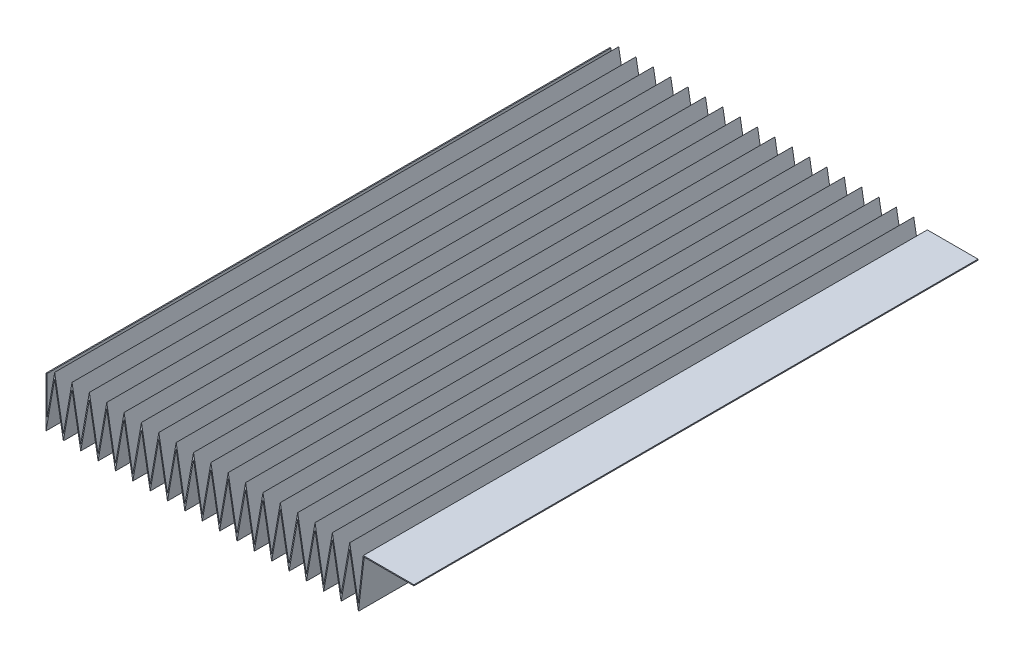
from build123d import *

# Parameters (mm, degrees)
EXTRUDE_THIN1_DEPTH = 85


with BuildPart() as part:
    # Sketch1 → Extrude-Thin1 (new, symmetric)
    with BuildSketch(Plane.XY):
        Polygon((0, 15.1), (0, 0), (2.615768825, 14.871709836), (5.23153765, 0), (7.847306476, 14.871709836), (10.463075301, 0), (13.078844126, 14.871709836), (15.694612951, 0), (18.310381776, 14.871709836), (20.926150602, 0), (23.541919427, 14.871709836), (26.157688252, 0), (28.773457077, 14.871709836), (31.389225902, 0), (34.004994728, 14.871709836), (36.620763553, 0), (39.236532378, 14.871709836), (41.852301203, 0), (44.468070028, 14.871709836), (47.083838854, 0), (49.699607679, 14.871709836), (52.315376504, 0), (54.931145329, 14.871709836), (57.546914154, 0), (60.16268298, 14.871709836), (62.778451805, 0), (65.39422063, 14.871709836), (68.009989455, 0), (70.62575828, 14.871709836), (73.241527106, 0), (75.857295931, 14.871709836), (78.473064756, 0), (81.088833581, 14.871709836), (83.704602406, 0), (86.320371232, 14.871709836), (88.936140057, 0), (91.551908882, 14.871709836), (94.167677707, 0), (95.902612864, 15), (110.902612864, 15), (110.902612864, 15.3), (95.635311568, 15.3), (94.106326229, 2.080612527), (91.551908882, 16.603514251), (88.936140057, 1.731804415), (86.320371232, 16.603514251), (83.704602406, 1.731804415), (81.088833581, 16.603514251), (78.473064756, 1.731804415), (75.857295931, 16.603514251), (73.241527106, 1.731804415), (70.62575828, 16.603514251), (68.009989455, 1.731804415), (65.39422063, 16.603514251), (62.778451805, 1.731804415), (60.16268298, 16.603514251), (57.546914154, 1.731804415), (54.931145329, 16.603514251), (52.315376504, 1.731804415), (49.699607679, 16.603514251), (47.083838854, 1.731804415), (44.468070028, 16.603514251), (41.852301203, 1.731804415), (39.236532378, 16.603514251), (36.620763553, 1.731804415), (34.004994728, 16.603514251), (31.389225902, 1.731804415), (28.773457077, 16.603514251), (26.157688252, 1.731804415), (23.541919427, 16.603514251), (20.926150602, 1.731804415), (18.310381776, 16.603514251), (15.694612951, 1.731804415), (13.078844126, 16.603514251), (10.463075301, 1.731804415), (7.847306476, 16.603514251), (5.23153765, 1.731804415), (2.615768825, 16.603514251), (0.3, 3.437426452), (0.3, 15.1), align=None)
    extrude(amount=EXTRUDE_THIN1_DEPTH, both=True)


solid = part.part
